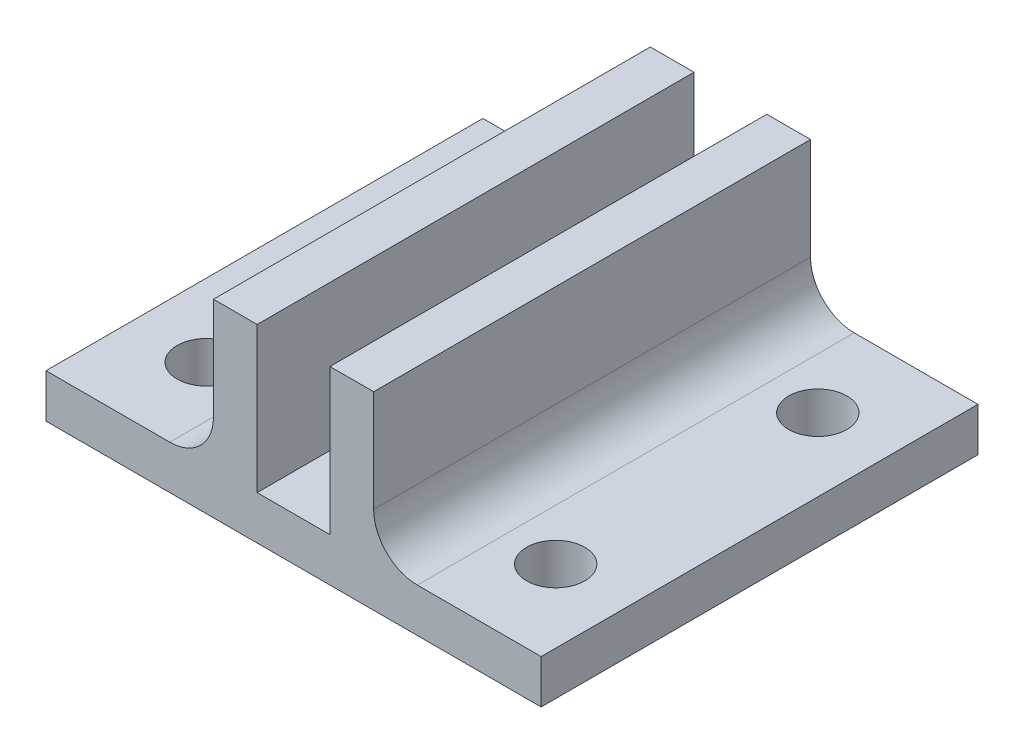
from build123d import *

# Parameters (mm, degrees)
BOSS_EXTRUDE1_DEPTH = 30
SKETCH2_R           = 2
CUT_EXTRUDE1_DEPTH  = 3
FILLET1_R           = 3


with BuildPart() as part:
    # Sketch1 → Boss-Extrude1 (new body)
    with BuildSketch(Plane(origin=(-298.953701388, 67.353578403, 0), x_dir=(1, 0, 0), z_dir=(0, 0, 1))):
        Polygon((318.453701388, -54.353578403), (318.453701388, -64.353578403), (313.453701388, -64.353578403), (313.453701388, -54.353578403), (310.453701388, -54.353578403), (310.453701388, -64.353578403), (298.953701388, -64.353578403), (298.953701388, -67.353578403), (332.953701388, -67.353578403), (332.953701388, -64.353578403), (321.453701388, -64.353578403), (321.453701388, -54.353578403), align=None)
    extrude(amount=BOSS_EXTRUDE1_DEPTH)

    # Sketch2 → Cut-Extrude1 (cut)
    with BuildSketch(Plane(origin=(0, 3, 0), x_dir=(1, 0, 0), z_dir=(0, 1, 0))):
        with Locations(Location((29, -6, 0), (0, 0, 270))):
            Circle(SKETCH2_R)
        with Locations(Location((29, -24, 0), (0, 0, 270))):
            Circle(SKETCH2_R)
    cut_extrude1 = extrude(amount=-CUT_EXTRUDE1_DEPTH, mode=Mode.SUBTRACT)

    # Mirror1: Cut-Extrude1 across plane
    add(cut_extrude1.mirror(Plane(origin=(17, 0, 0), x_dir=(0, 0, 1), z_dir=(1, 0, 0))), mode=Mode.SUBTRACT)

    # Fillet1
    fillet1_edges = [part.edges().sort_by_distance(p)[0] for p in [
        (11.5, 3, 15),
        (22.5, 3, 15),
    ]]
    fillet(fillet1_edges, radius=FILLET1_R)


solid = part.part
